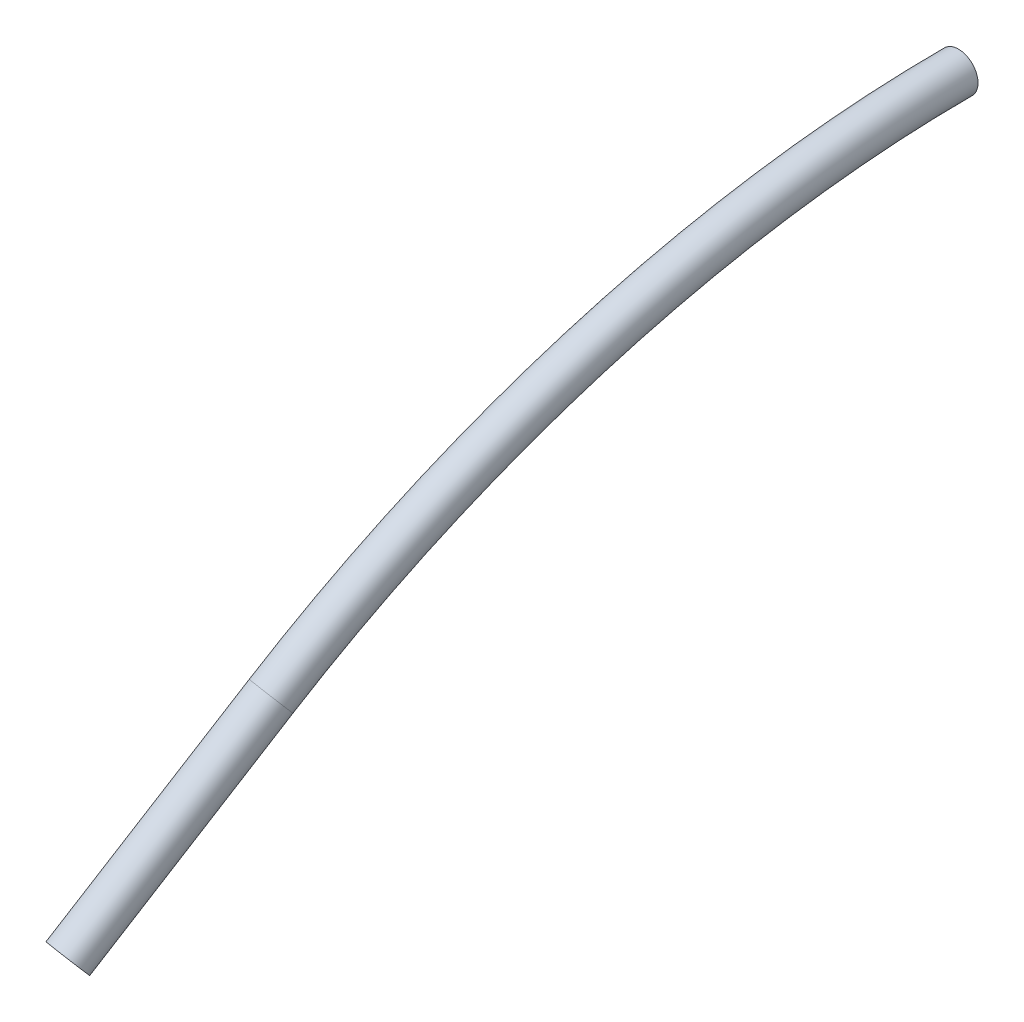
from build123d import *

# Parameters (mm, degrees)
SKETCH1_R = 50.8


with BuildPart() as part:
    # Sweep1: sweep along a path in Sketch2
    with BuildLine(Plane(origin=(3153.382024828, -564.057160281, 0), x_dir=(-0.16989413075526108, -0.9497993036384053, -0.26271137612009643), z_dir=(0.984376038822768, -0.17607899985971218, 0))) as sweep1_path:
        Line((-3664.240978331, -1209.886716378), (-3933.757526792, -663.102490101))
        ThreePointArc((-3933.757526792, -663.102490101), (-4182.468728065, 211.645639141), (-4105.367146293, 1117.789610781))
    # Sketch1 → Sweep1 (sweep)
    with BuildSketch(Plane(origin=(0.010579982, -0.015258363, 0), x_dir=(-0.2924102116577808, 0.9562929823638006, 0), z_dir=(0, 0, 1))):
        with Locations((2324.746352302, -4791.769413836)):
            Circle(SKETCH1_R)
    sweep(path=sweep1_path.line)


solid = part.part
